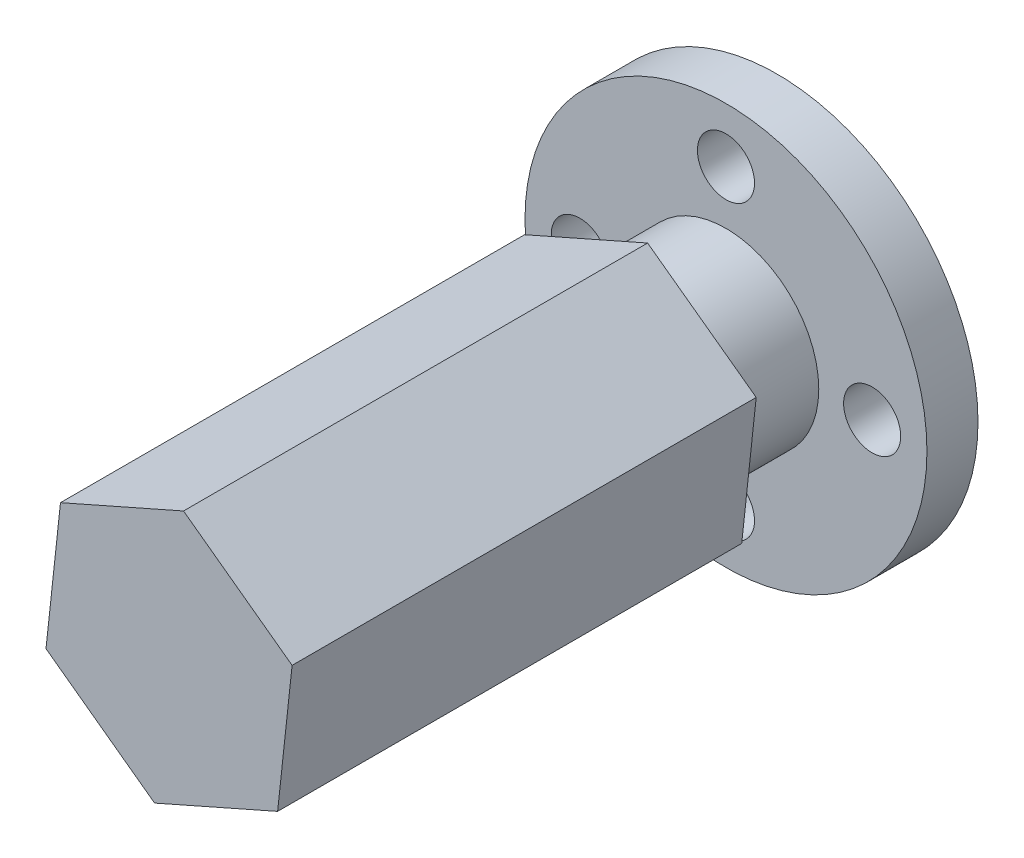
from build123d import *

# Parameters (mm, degrees)
SKETCH1_R           = 11.000000098
SKETCH1_R_2         = 4.1984422
SKETCH1_R_3         = 1.56235781
BOSS_EXTRUDE1_DEPTH = 2.794
SKETCH4_R           = 5.08
BOSS_EXTRUDE2_DEPTH = 5.08
BOSS_EXTRUDE4_DEPTH = 25.4


with BuildPart() as part:
    # Sketch1 → Boss-Extrude1 (new body)
    with BuildSketch(Plane.XY):
        with Locations((-211.672901702, 6.35719782)):
            Circle(SKETCH1_R)
        with Locations((-211.672901702, 6.35719782)):
            Circle(SKETCH1_R_2, mode=Mode.SUBTRACT)
        with Locations((-211.672901702, 14.35819782)):
            Circle(SKETCH1_R_3, mode=Mode.SUBTRACT)
        with Locations((-219.673901702, 6.35719782)):
            Circle(SKETCH1_R_3, mode=Mode.SUBTRACT)
        with Locations((-211.672901702, -1.64380218)):
            Circle(SKETCH1_R_3, mode=Mode.SUBTRACT)
        with Locations((-203.671901702, 6.35719782)):
            Circle(SKETCH1_R_3, mode=Mode.SUBTRACT)
    extrude(amount=BOSS_EXTRUDE1_DEPTH)

    # Sketch4 → Boss-Extrude2 (add)
    with BuildSketch(Plane.XY.offset(2.794)):
        with Locations((-211.672901702, 6.35719782)):
            Circle(SKETCH4_R)
    extrude(amount=BOSS_EXTRUDE2_DEPTH)

    # Sketch6 → Boss-Extrude4 (add)
    with BuildSketch(Plane.XY.offset(7.874)):
        Polygon((-217.614895912, 10.703116021), (-210.880223241, 13.676074856), (-204.938229031, 9.330156654), (-205.730907491, 2.011279618), (-212.465580162, -0.961679217), (-218.407574373, 3.384238985), align=None)
    extrude(amount=BOSS_EXTRUDE4_DEPTH)


solid = part.part
